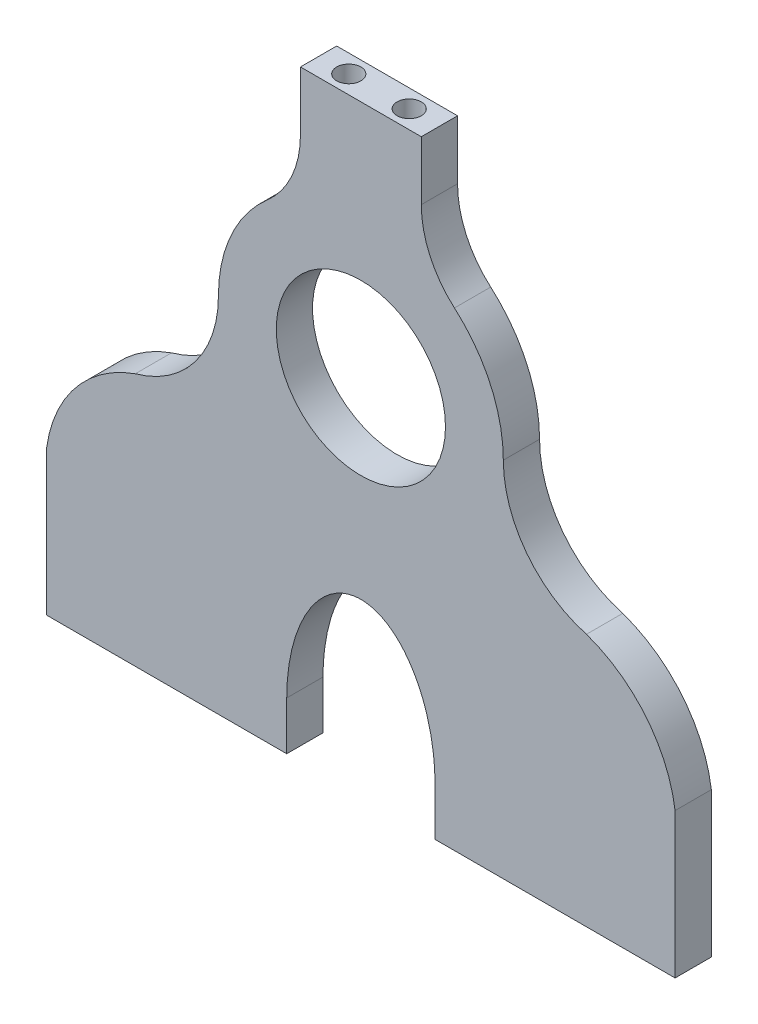
from build123d import *

# Parameters (mm, degrees)
SKETCH1_R           = 19.61817075
BOSS_EXTRUDE1_DEPTH = 3.175
FILLET1_R           = 25.4
SKETCH2_R           = 15.875
BOSS_EXTRUDE2_DEPTH = 12.7
CUT_EXTRUDE3_START  = -6.35
SKETCH5_R           = 15.875
CUT_EXTRUDE3_DEPTH  = 6.35
SKETCH3_R           = 3.175
CUT_EXTRUDE1_DEPTH  = 12.7
SKETCH4_R           = 3.175
CUT_EXTRUDE2_DEPTH  = 12.7
CUT_EXTRUDE4_START  = -23.876
SKETCH7_R           = 22.225
SKETCH7_R_2         = 15.875
CUT_EXTRUDE4_DEPTH  = 23.876


with BuildPart() as part:
    # Sketch1 → Boss-Extrude1 (new body)
    with BuildSketch(Plane.XY):
        with BuildLine():
            ThreePointArc((44.489667751, 31.288325121), (28.726604254, 41.946482698), (22.64318373, 59.97597211))
            ThreePointArc((22.64318373, 59.97597211), (16.800558188, 80.054274158), (1.097123352, 93.862844712))
            Line((1.097123352, 93.862844712), (1.097123352, 122.797032487))
            Line((1.097123352, 122.797032487), (-30.652876648, 122.797032487))
            Line((-30.652876648, 122.797032487), (-30.652876648, 93.862844712))
            ThreePointArc((-30.652876648, 93.862844712), (-46.356311483, 80.054274158), (-52.198937025, 59.97597211))
            ThreePointArc((-52.198937025, 59.97597211), (-58.282357549, 41.946482698), (-74.045421046, 31.288325121))
            ThreePointArc((-74.045421046, 31.288325121), (-89.694055432, 20.335242519), (-97.327876648, 2.82597211))
            Line((-97.327876648, 2.82597211), (-97.327876648, -35.27402789))
            Line((-97.327876648, -35.27402789), (-34.257381722, -35.27402789))
            Line((-34.257381722, -35.27402789), (-34.257381722, -22.57402789))
            add(Edge.make_bspline(
                [(4.701628427, -22.57402789), (4.701628427, 9.595471172), (-14.777876648, 9.595471172), (-34.257381722, 9.595471172), (-34.257381722, -22.57402789)],
                knots=[1.570796327, 1.570796327, 1.570796327, 3.141592654, 3.141592654, 4.71238898, 4.71238898, 4.71238898], degree=2, weights=[1, 0.707106781, 1, 0.707106781, 1]))
            Line((4.701628427, -22.57402789), (4.701628427, -35.27402789))
            Line((4.701628427, -35.27402789), (67.772123352, -35.27402789))
            Line((67.772123352, -35.27402789), (67.772123352, 2.82597211))
            ThreePointArc((67.772123352, 2.82597211), (60.138302137, 20.335242519), (44.489667751, 31.288325121))
        make_face()
        with Locations((-14.777876648, 59.97597211)):
            Circle(SKETCH1_R, mode=Mode.SUBTRACT)
    extrude(amount=BOSS_EXTRUDE1_DEPTH)

    # Fillet1
    fillet1_edges = [part.edges().sort_by_distance(p)[0] for p in [
        (-30.652876648, 93.862844712, 1.5875),
        (1.097123352, 93.862844712, 1.5875),
    ]]
    fillet(fillet1_edges, radius=FILLET1_R)

    # Sketch2 → Boss-Extrude2 (add)
    with BuildSketch(Plane.XY.offset(3.175)):
        with BuildLine():
            Line((1.097123352, 107.334815022), (1.097123352, 122.797032487))
            Line((1.097123352, 122.797032487), (-30.652876648, 122.797032487))
            Line((-30.652876648, 122.797032487), (-30.652876648, 107.334815022))
            ThreePointArc((-30.652876648, 107.334815022), (-32.933121295, 96.816406756), (-39.364444557, 88.186545274))
            ThreePointArc((-39.364444557, 88.186545274), (-48.83952078, 75.47242844), (-52.198937025, 59.97597211))
            ThreePointArc((-52.198937025, 59.97597211), (-58.282357549, 41.946482698), (-74.045421046, 31.288325121))
            ThreePointArc((-74.045421046, 31.288325121), (-89.694055432, 20.335242519), (-97.327876648, 2.82597211))
            Line((-97.327876648, 2.82597211), (-97.327876648, -35.27402789))
            Line((-97.327876648, -35.27402789), (-34.257381722, -35.27402789))
            Line((-34.257381722, -35.27402789), (-34.257381722, -22.57402789))
            add(Edge.make_bspline(
                [(4.701628427, -22.57402789), (4.701628427, 9.595471172), (-14.777876648, 9.595471172), (-34.257381722, 9.595471172), (-34.257381722, -22.57402789)],
                knots=[1.570796327, 1.570796327, 1.570796327, 3.141592654, 3.141592654, 4.71238898, 4.71238898, 4.71238898], degree=2, weights=[1, 0.707106781, 1, 0.707106781, 1]))
            Line((4.701628427, -22.57402789), (4.701628427, -35.27402789))
            Line((4.701628427, -35.27402789), (67.772123352, -35.27402789))
            Line((67.772123352, -35.27402789), (67.772123352, 2.82597211))
            ThreePointArc((67.772123352, 2.82597211), (60.138302137, 20.335242519), (44.489667751, 31.288325121))
            ThreePointArc((44.489667751, 31.288325121), (28.726604254, 41.946482698), (22.64318373, 59.97597211))
            ThreePointArc((22.64318373, 59.97597211), (19.283767485, 75.47242844), (9.808691261, 88.186545274))
            ThreePointArc((9.808691261, 88.186545274), (3.377368, 96.816406756), (1.097123352, 107.334815022))
        make_face()
        with Locations((-14.777876648, 59.97597211)):
            Circle(SKETCH2_R, mode=Mode.SUBTRACT)
    extrude(amount=BOSS_EXTRUDE2_DEPTH)

    # Sketch5 → Cut-Extrude3 (cut)
    with BuildSketch(Plane.XY.offset(15.875).offset(CUT_EXTRUDE3_START)):
        with BuildLine():
            Line((1.097123352, 107.334815022), (1.097123352, 122.797032487))
            Line((1.097123352, 122.797032487), (-30.652876648, 122.797032487))
            Line((-30.652876648, 122.797032487), (-30.652876648, 107.334815022))
            ThreePointArc((-30.652876648, 107.334815022), (-32.933121295, 96.816406756), (-39.364444557, 88.186545274))
            ThreePointArc((-39.364444557, 88.186545274), (-48.83952078, 75.47242844), (-52.198937025, 59.97597211))
            ThreePointArc((-52.198937025, 59.97597211), (-58.282357549, 41.946482698), (-74.045421046, 31.288325121))
            ThreePointArc((-74.045421046, 31.288325121), (-89.694055432, 20.335242519), (-97.327876648, 2.82597211))
            Line((-97.327876648, 2.82597211), (-97.327876648, -35.27402789))
            Line((-97.327876648, -35.27402789), (-34.257381722, -35.27402789))
            Line((-34.257381722, -35.27402789), (-34.257381722, -22.57402789))
            add(Edge.make_bspline(
                [(4.701628427, -22.57402789), (4.701628427, 9.595471172), (-14.777876648, 9.595471172), (-34.257381722, 9.595471172), (-34.257381722, -22.57402789)],
                knots=[1.570796327, 1.570796327, 1.570796327, 3.141592654, 3.141592654, 4.71238898, 4.71238898, 4.71238898], degree=2, weights=[1, 0.707106781, 1, 0.707106781, 1]))
            Line((4.701628427, -22.57402789), (4.701628427, -35.27402789))
            Line((4.701628427, -35.27402789), (67.772123352, -35.27402789))
            Line((67.772123352, -35.27402789), (67.772123352, 2.82597211))
            ThreePointArc((67.772123352, 2.82597211), (60.138302137, 20.335242519), (44.489667751, 31.288325121))
            ThreePointArc((44.489667751, 31.288325121), (28.726604254, 41.946482698), (22.64318373, 59.97597211))
            ThreePointArc((22.64318373, 59.97597211), (19.283767485, 75.47242844), (9.808691261, 88.186545274))
            ThreePointArc((9.808691261, 88.186545274), (3.377368, 96.816406756), (1.097123352, 107.334815022))
        make_face()
        with Locations((-14.777876648, 59.97597211)):
            Circle(SKETCH5_R, mode=Mode.SUBTRACT)
    extrude(amount=CUT_EXTRUDE3_DEPTH, mode=Mode.SUBTRACT)

    # Sketch3 → Cut-Extrude1 (cut)
    with BuildSketch(Plane.XZ.offset(35.27402789)):
        with Locations((-50.025005454, 4.7625)):
            Circle(SKETCH3_R)
        with Locations((-81.560252916, 4.7625)):
            Circle(SKETCH3_R)
        with Locations(Location((20.469252158, 4.7625, 0), (0, 0, 180))):
            Circle(SKETCH3_R)
        with Locations(Location((52.004499621, 4.7625, 0), (0, 0, 180))):
            Circle(SKETCH3_R)
    extrude(amount=-CUT_EXTRUDE1_DEPTH, mode=Mode.SUBTRACT)

    # Sketch4 → Cut-Extrude2 (cut)
    with BuildSketch(Plane(origin=(0, 122.797032487, 0), x_dir=(1, 0, 0), z_dir=(0, 1, 0))):
        with Locations(Location((-22.715376648, -4.7625, 0), (0, 0, 270))):
            Circle(SKETCH4_R)
        with Locations(Location((-6.840376648, -4.7625, 0), (0, 0, 270))):
            Circle(SKETCH4_R)
    extrude(amount=-CUT_EXTRUDE2_DEPTH, mode=Mode.SUBTRACT)

    # Sketch7 → Cut-Extrude4 (cut)
    with BuildSketch(Plane.XY.offset(9.525).offset(CUT_EXTRUDE4_START)):
        with Locations((-14.777876648, 59.97597211)):
            Circle(SKETCH7_R)
        with Locations((-14.777876648, 59.97597211)):
            Circle(SKETCH7_R_2, mode=Mode.SUBTRACT)
    extrude(amount=CUT_EXTRUDE4_DEPTH, mode=Mode.SUBTRACT)


solid = part.part
